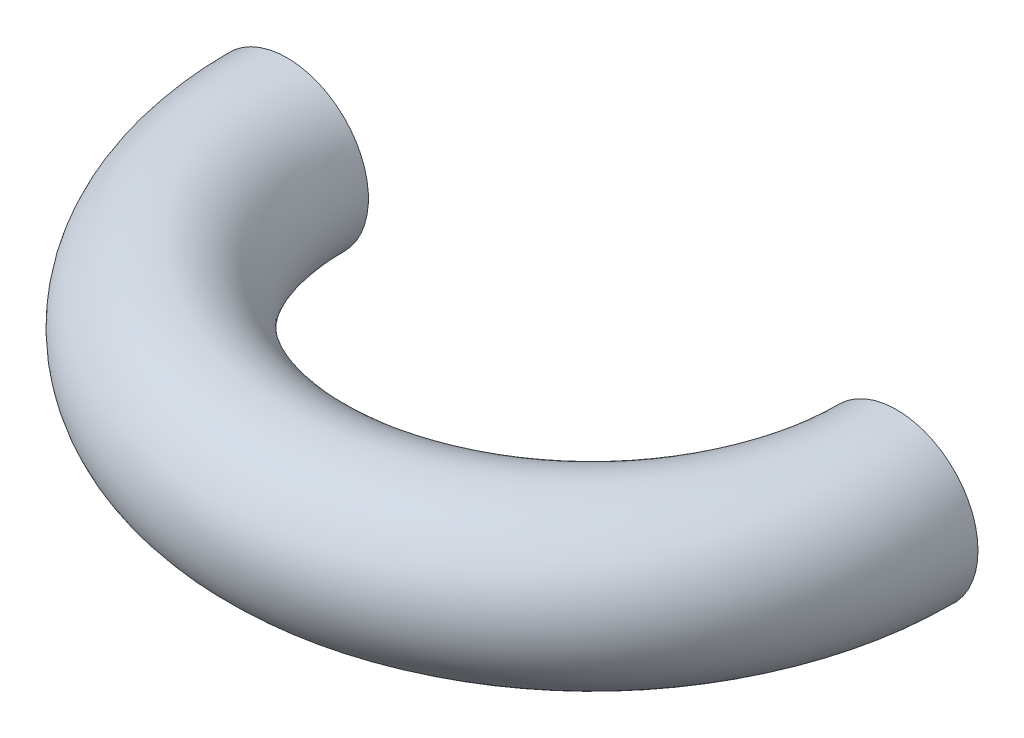
from build123d import *

# Parameters (mm, degrees)
SKETCH_1_R      = 1
REVOLVE_1_ANGLE = 180


with BuildPart() as part:
    # Эскиз1 → Повернуть1 (revolve)
    with BuildSketch(Plane.XY):
        with Locations((3.75, 0)):
            Circle(SKETCH_1_R)
    revolve(axis=Axis((0, 7.875358067, 0), (0, -1, 0)), revolution_arc=REVOLVE_1_ANGLE)


solid = part.part
